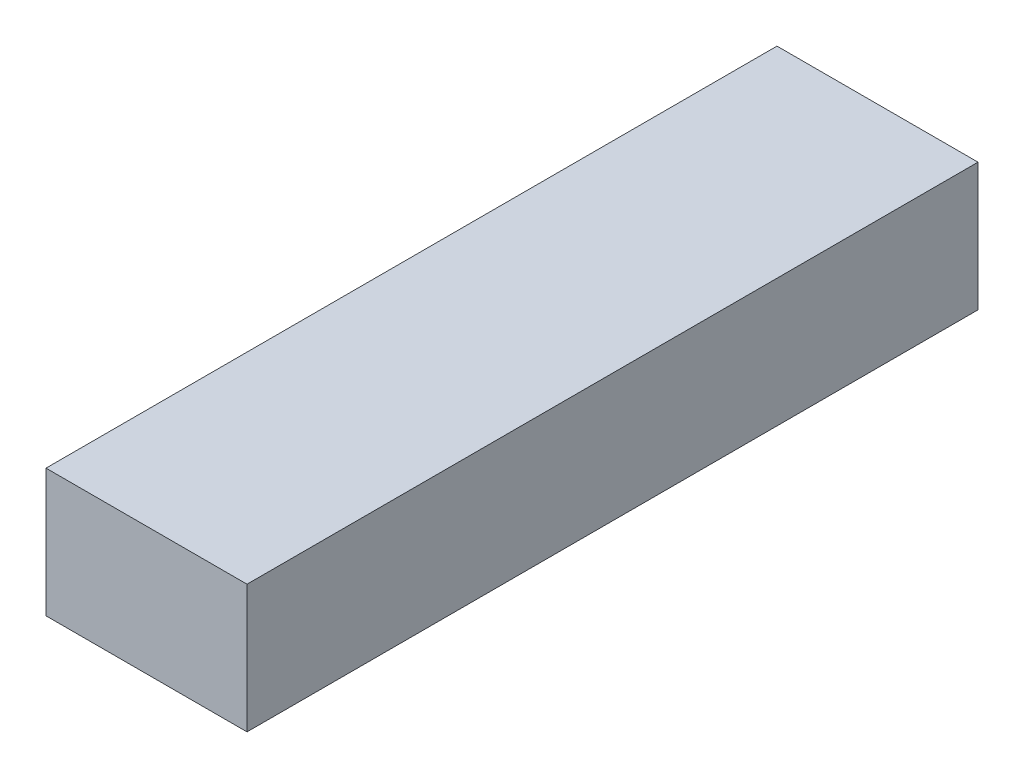
from build123d import *

# Parameters (mm, degrees)
SKETCH1_W           = 22
SKETCH1_H           = 14
BOSS_EXTRUDE1_DEPTH = 80


with BuildPart() as part:
    # Sketch1 → Boss-Extrude1 (new body)
    with BuildSketch(Plane.XY):
        Rectangle(SKETCH1_W, SKETCH1_H)
    extrude(amount=-BOSS_EXTRUDE1_DEPTH)


solid = part.part
